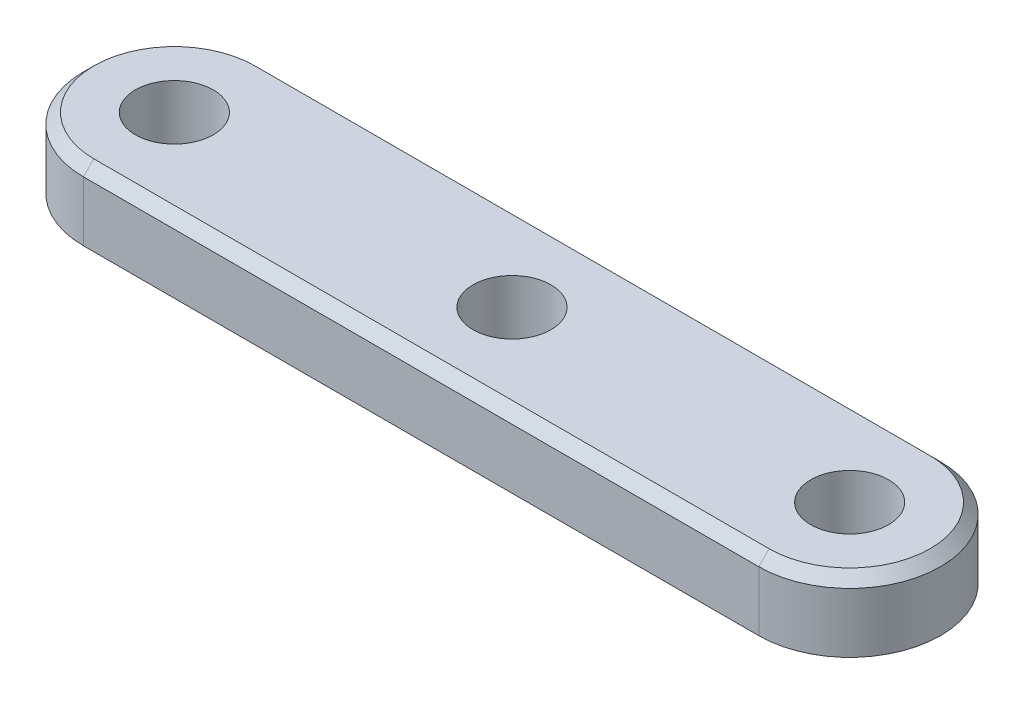
from build123d import *

# Parameters (mm, degrees)
SKETCH1_R           = 1.5
BOSS_EXTRUDE1_DEPTH = 1.35
CHAMFER1_SIZE       = 0.4


with BuildPart() as part:
    # Sketch1 → Boss-Extrude1 (new, symmetric)
    with BuildSketch(Plane(origin=(0, 0, 0), x_dir=(1, 0, 0), z_dir=(0, 1, 0))):
        with BuildLine():
            Line((-13, 3.5), (13, 3.5))
            ThreePointArc((13, 3.5), (16.5, 0), (13, -3.5))
            Line((13, -3.5), (-13, -3.5))
            ThreePointArc((-13, -3.5), (-16.5, 0), (-13, 3.5))
        make_face()
        with Locations(Location((-13, 0, 0), (0, 0, 90))):
            Circle(SKETCH1_R, mode=Mode.SUBTRACT)
        with Locations(Location((13, 0, 0), (0, 0, 90))):
            Circle(SKETCH1_R, mode=Mode.SUBTRACT)
        with Locations(Location((0, 0, 0), (0, 0, 90))):
            Circle(SKETCH1_R, mode=Mode.SUBTRACT)
    extrude(amount=BOSS_EXTRUDE1_DEPTH, both=True)

    # Chamfer1
    chamfer1_edges = [part.edges().sort_by_distance(p)[0] for p in [
        (16.5, 1.35, 0),
        (0, 1.35, -3.5),
        (-16.5, 1.35, 0),
        (0, 1.35, 3.5),
    ]]
    chamfer(chamfer1_edges, length=CHAMFER1_SIZE)


solid = part.part
